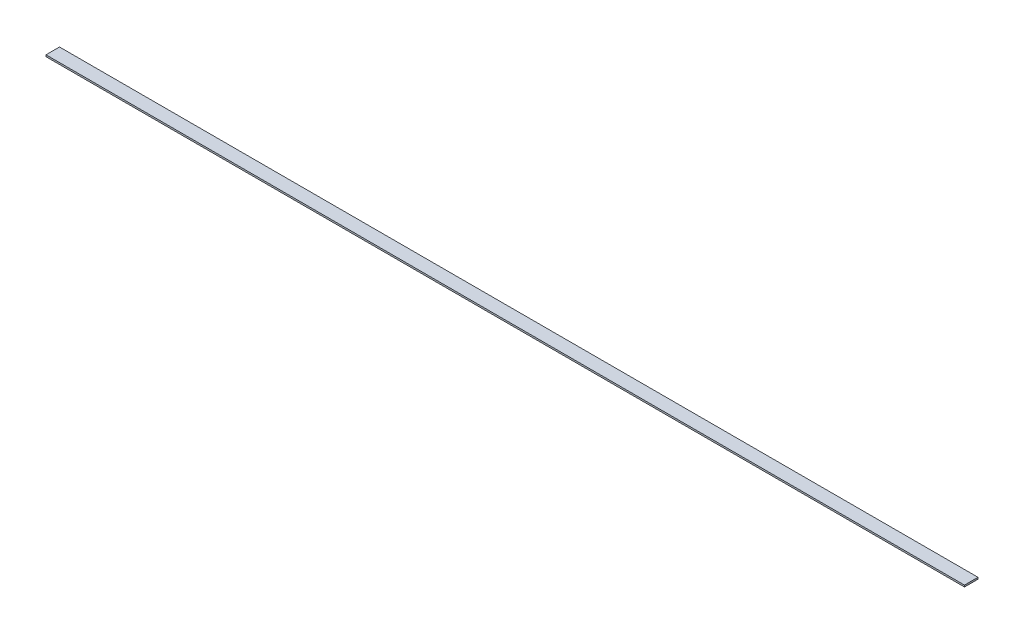
from build123d import *

# Parameters (mm, degrees)
SKETCH1_W           = 1727.2
SKETCH1_H           = 25.4
BOSS_EXTRUDE1_DEPTH = 3.175


with BuildPart() as part:
    # Sketch1 → Boss-Extrude1 (new body)
    with BuildSketch(Plane(origin=(0, 0, 0), x_dir=(1, 0, 0), z_dir=(0, 1, 0))):
        Rectangle(SKETCH1_W, SKETCH1_H)
    extrude(amount=BOSS_EXTRUDE1_DEPTH)


solid = part.part
